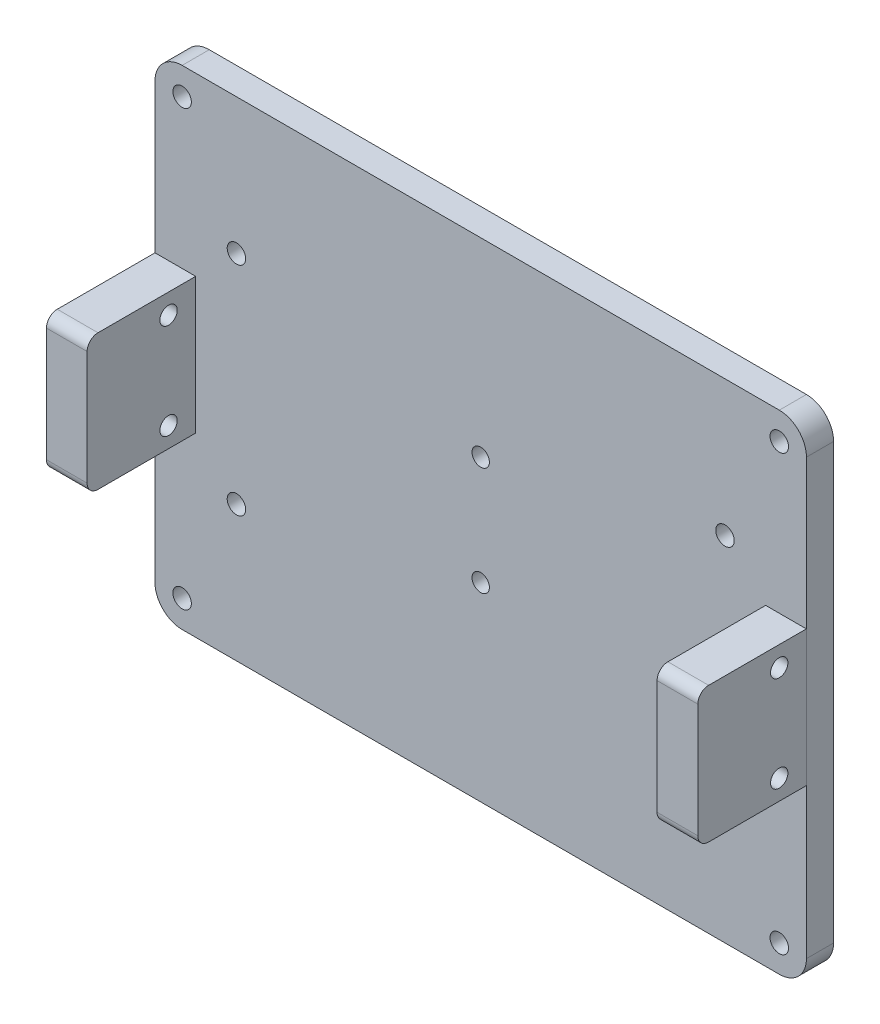
from build123d import *

# Parameters (mm, degrees)
EXTRUDE_1_DEPTH        = 5
SKETCH_1_4_OUTSIDE_W   = 152.016
SKETCH_1_4_OUTSIDE_H   = 122.016
SKETCH_1_4_OUTSIDE_R   = 1.7
SKETCH_1_4_OUTSIDE_R_2 = 1.6
CUT_EXTRUDE_3_DEPTH    = 84.683501662
SKETCH_2_W             = 7.5
SKETCH_2_H             = 25
EXTRUDE_2_DEPTH        = 20
FILLET_1_R             = 2
SKETCH_6_R             = 1.6
CUT_EXTRUDE_4_DEPTH    = 7.5
SKETCH_7_R             = 1.6
CUT_EXTRUDE_5_DEPTH    = 134.554368416


with BuildPart() as part:
    # 스케치1 → 보스-돌출1 (new body)
    with BuildSketch(Plane.XY):
        with BuildLine():
            Line((-57.749377558, 34.859778143), (52.250622442, 34.859778143))
            ThreePointArc((52.250622442, 34.859778143), (55.786156348, 33.395312049), (57.250622442, 29.859778143))
            Line((57.250622442, 29.859778143), (57.250622442, -50.140221857))
            ThreePointArc((57.250622442, -50.140221857), (55.786156348, -53.675755763), (52.250622442, -55.140221857))
            Line((52.250622442, -55.140221857), (-57.749377558, -55.140221857))
            ThreePointArc((-57.749377558, -55.140221857), (-61.284911464, -53.675755763), (-62.749377558, -50.140221857))
            Line((-62.749377558, -50.140221857), (-62.749377558, 29.859778143))
            ThreePointArc((-62.749377558, 29.859778143), (-61.284911464, 33.395312049), (-57.749377558, 34.859778143))
        make_face()
    extrude(amount=-EXTRUDE_1_DEPTH)

    # 스케치1<4> outside → 컷-돌출3 (cut, through all)
    # profile 1 of 11: a face of its own
    with BuildSketch(Plane.XY):
        with Locations((-2.749, -10.14)):
            Rectangle(SKETCH_1_4_OUTSIDE_W, SKETCH_1_4_OUTSIDE_H)
        with BuildLine():
            Line((-57.749377558, 34.859778143), (52.250622442, 34.859778143))
            ThreePointArc((52.250622442, 34.859778143), (55.786156348, 33.395312049), (57.250622442, 29.859778143))
            Line((57.250622442, 29.859778143), (57.250622442, -50.140221857))
            ThreePointArc((57.250622442, -50.140221857), (55.786156348, -53.675755763), (52.250622442, -55.140221857))
            Line((52.250622442, -55.140221857), (-57.749377558, -55.140221857))
            ThreePointArc((-57.749377558, -55.140221857), (-61.284911464, -53.675755763), (-62.749377558, -50.140221857))
            Line((-62.749377558, -50.140221857), (-62.749377558, 29.859778143))
            ThreePointArc((-62.749377558, 29.859778143), (-61.284911464, 33.395312049), (-57.749377558, 34.859778143))
        make_face(mode=Mode.SUBTRACT)
    # profile 2 of 11: a face of its own
    with BuildSketch(Plane.XY):
        with Locations((-57.749377558, 29.859778143)):
            Circle(SKETCH_1_4_OUTSIDE_R)
    # profile 3 of 11: a face of its own
    with BuildSketch(Plane.XY):
        with Locations((52.250622442, 29.859778143)):
            Circle(SKETCH_1_4_OUTSIDE_R)
    # profile 4 of 11: a face of its own
    with BuildSketch(Plane.XY):
        with Locations((-57.749377558, -50.140221857)):
            Circle(SKETCH_1_4_OUTSIDE_R)
    # profile 5 of 11: a face of its own
    with BuildSketch(Plane.XY):
        with Locations((52.250622442, -50.140221857)):
            Circle(SKETCH_1_4_OUTSIDE_R)
    # profile 6 of 11: a face of its own
    with BuildSketch(Plane.XY):
        with Locations((-47.749377558, 9.859778143)):
            Circle(SKETCH_1_4_OUTSIDE_R)
    # profile 7 of 11: a face of its own
    with BuildSketch(Plane.XY):
        with Locations((-47.749377558, -30.140221857)):
            Circle(SKETCH_1_4_OUTSIDE_R)
    # profile 8 of 11: a face of its own
    with BuildSketch(Plane.XY):
        with Locations((42.250622442, 9.859778143)):
            Circle(SKETCH_1_4_OUTSIDE_R)
    # profile 9 of 11: a face of its own
    with BuildSketch(Plane.XY):
        with Locations((42.250622442, -30.140221857)):
            Circle(SKETCH_1_4_OUTSIDE_R)
    # profile 10 of 11: a face of its own
    with BuildSketch(Plane.XY):
        with Locations((-2.74831555, -0.140221857)):
            Circle(SKETCH_1_4_OUTSIDE_R_2)
    # profile 11 of 11: a face of its own
    with BuildSketch(Plane.XY):
        with Locations((-2.74831555, -20.140221857)):
            Circle(SKETCH_1_4_OUTSIDE_R_2)
    extrude(amount=-CUT_EXTRUDE_3_DEPTH, mode=Mode.SUBTRACT)

    # 스케치2 → 보스-돌출2 (add)
    with BuildSketch(Plane.XY):
        with Locations((-58.999377558, -10.043662602)):
            Rectangle(SKETCH_2_W, SKETCH_2_H)
        with Locations((53.485310034, -10.043662602)):
            Rectangle(SKETCH_2_W, SKETCH_2_H)
    extrude(amount=EXTRUDE_2_DEPTH)

    # 필렛1
    fillet_1_edges = [part.edges().sort_by_distance(p)[0] for p in [
        (-58.999377558, -22.543662602, 20),
        (-58.999377558, 2.456337398, 20),
        (53.485310034, 2.456337398, 20),
        (53.485310034, -22.543662602, 20),
    ]]
    fillet(fillet_1_edges, radius=FILLET_1_R)

    # 스케치6 → 컷-돌출4 (cut)
    with BuildSketch(Plane.ZY.offset(62.749377558)):
        with Locations(Location((5, -18.843662602, 0), (0, 0, 270))):
            Circle(SKETCH_6_R)
        with Locations(Location((5, -1.243662602, 0), (0, 0, 270))):
            Circle(SKETCH_6_R)
    extrude(amount=-CUT_EXTRUDE_4_DEPTH, mode=Mode.SUBTRACT)

    # 스케치7 → 컷-돌출5 (cut, through all)
    with BuildSketch(Plane(origin=(57.235310034, 0, 0), x_dir=(0, 0, -1), z_dir=(1, 0, 0))):
        with Locations(Location((-5, -1.243662602, 0), (0, 0, 270))):
            Circle(SKETCH_7_R)
        with Locations(Location((-5, -18.843662602, 0), (0, 0, 270))):
            Circle(SKETCH_7_R)
    extrude(amount=-CUT_EXTRUDE_5_DEPTH, mode=Mode.SUBTRACT)


solid = part.part
